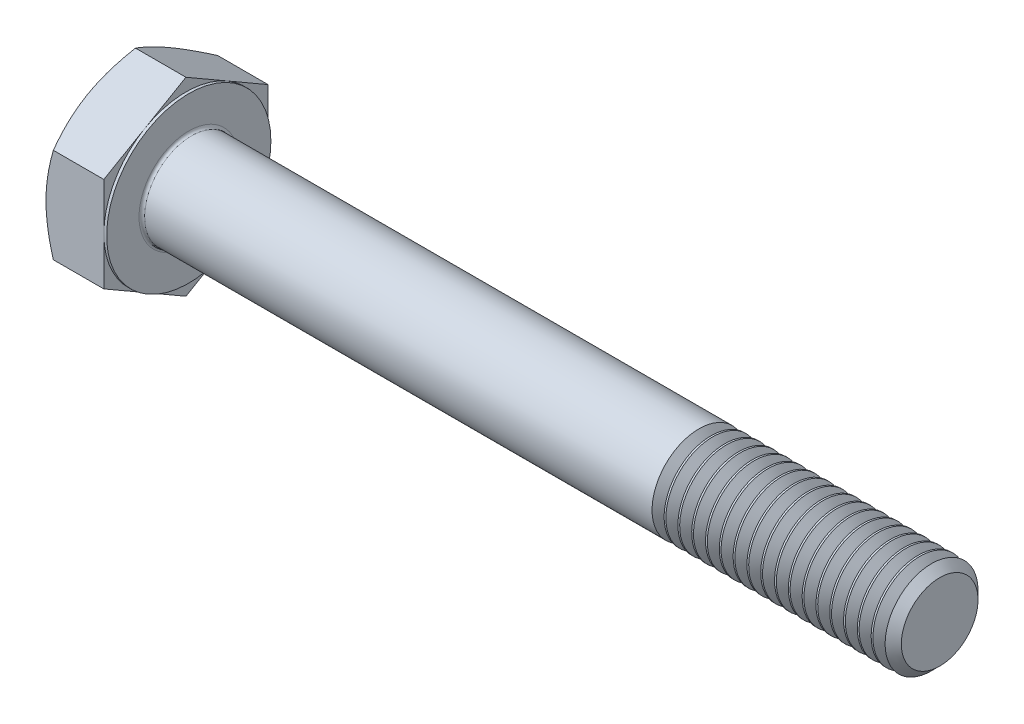
from build123d import *

# Parameters (mm, degrees)
BASEHEAD_DEPTH  = 8.2042
SKETCH4_W       = 0.381
SKETCH4_H       = 27.119109733
HEADFILLET_R    = 0.381
THDSCHPAT_COUNT = 17
THDSCHPAT_PITCH = 1.867647059


with BuildPart() as part:
    # Sketch1 → BaseHead (new body)
    with BuildSketch(Plane(origin=(0, 0, 0), x_dir=(0, 0, -1), z_dir=(1, 0, 0))):
        Polygon((11.1125, 6.415804866), (11.1125, -6.415804866), (0, -12.831609733), (-11.1125, -6.415804866), (-11.1125, 6.415804866), (0, 12.831609733), align=None)
    extrude(amount=BASEHEAD_DEPTH)

    # BodySke → BaseBody (revolve)
    with BuildSketch(Plane.XY, mode=Mode.PRIVATE) as basebody_sk:
        Polygon((0, 0), (109.8042, 0), (109.8042, 5.18668), (108.64088, 6.35), (0, 6.35), align=None)
    revolve(basebody_sk.sketch.rotate(Axis((0, 0, 0), (1, 0, 0)), 90), axis=Axis((0, 0, 0), (1, 0, 0)))

    # Sketch3 → HeadChamfer (revolve, cut)
    with BuildSketch(Plane.XY):
        Polygon((0, 11.1125), (4.658702676, 19.181609733), (4.658702676, 25.531609733), (-12.7, 25.531609733), (-12.7, 11.1125), align=None)
    revolve(axis=Axis((0, 0, 0), (1, 0, 0)), mode=Mode.SUBTRACT)

    # Sketch4 → BearingFace (revolve, cut)
    with BuildSketch(Plane.XY, mode=Mode.PRIVATE) as bearingface_sk:
        with Locations((8.0137, 24.672054866)):
            Rectangle(SKETCH4_W, SKETCH4_H)
    revolve(bearingface_sk.sketch.rotate(Axis((0, 0, 0), (1, 0, 0)), 270), axis=Axis((0, 0, 0), (1, 0, 0)), mode=Mode.SUBTRACT)

    # HeadFillet
    headfillet_edges = [part.edges().sort_by_distance(p)[0] for p in [
        (8.2042, 0, -6.35),
    ]]
    fillet(headfillet_edges, radius=HEADFILLET_R)

    # ThdSchSke → ThreadSchematic (revolve, cut)
    with BuildSketch(Plane.XY):
        Polygon((78.0542, -5.18668), (77.239634567, -6.35), (77.239634567, -7.9375), (78.868765433, -7.9375), (78.868765433, -6.35), align=None)
    threadschematic = revolve(axis=Axis((-3.175, 0, 0), (1, 0, 0)), mode=Mode.SUBTRACT)

    # ThdSchPat: ThreadSchematic ×17
    with Locations(*[(i * THDSCHPAT_PITCH, 0, 0) for i in range(1, THDSCHPAT_COUNT)]):
        add(threadschematic, mode=Mode.SUBTRACT)


solid = part.part
